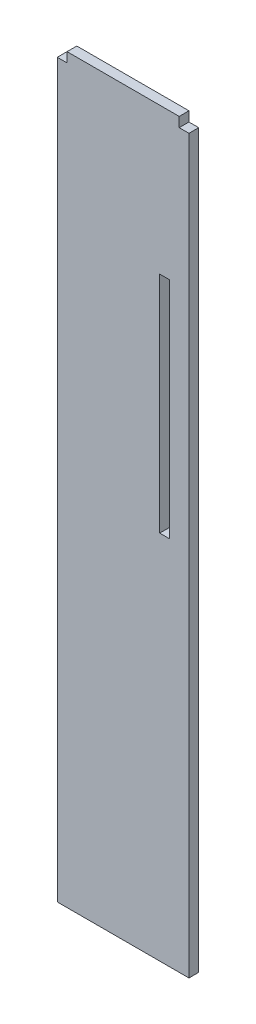
from build123d import *

# Parameters (mm, degrees)
BOSS_EXTRUDE1_DEPTH = 4
SKETCH2_W           = 4
SKETCH2_H           = 92
CUT_EXTRUDE1_DEPTH  = 309.784714648


with BuildPart() as part:
    # Sketch1 → Boss-Extrude1 (new body)
    with BuildSketch(Plane.XY):
        Polygon((0, 300), (4, 300), (4, 304), (50, 304), (50, 300), (54, 300), (54, 0), (0, 0), align=None)
    extrude(amount=BOSS_EXTRUDE1_DEPTH)

    # Sketch2 → Cut-Extrude1 (cut, through all)
    with BuildSketch(Plane.XY.offset(4)):
        with Locations((44, 198)):
            Rectangle(SKETCH2_W, SKETCH2_H)
    extrude(amount=-CUT_EXTRUDE1_DEPTH, mode=Mode.SUBTRACT)


solid = part.part
